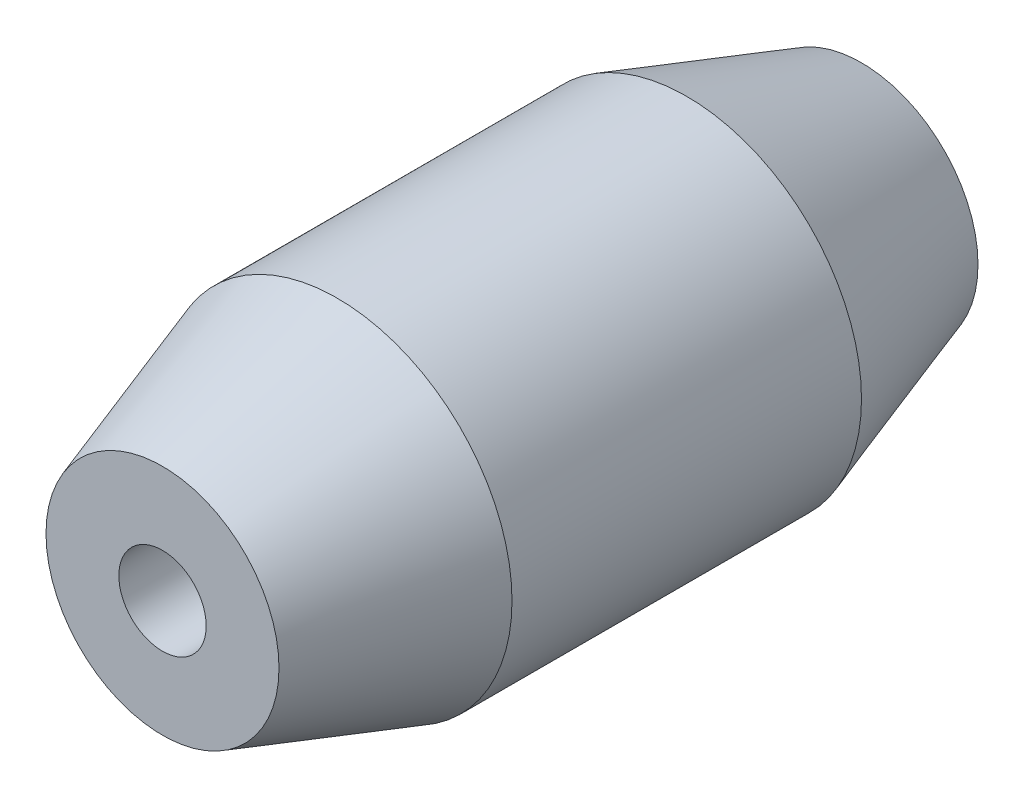
from build123d import *

# Parameters (mm, degrees)
ESQUISSE1_R        = 3
ESQUISSE1_R_2      = 0.75
BOSS_EXTRU_1_DEPTH = 12
CHANFREIN1_SIZE    = 3
CHANFREIN1_SIZE2   = 1
CHANFREIN2_SIZE    = 1
CHANFREIN2_SIZE2   = 3


with BuildPart() as part:
    # Esquisse1 → Boss.-Extru.1 (new body)
    with BuildSketch(Plane.XY):
        Circle(ESQUISSE1_R)
        Circle(ESQUISSE1_R_2, mode=Mode.SUBTRACT)
    extrude(amount=BOSS_EXTRU_1_DEPTH)

    # Chanfrein1
    chanfrein1_edges = [part.edges().sort_by_distance(p)[0] for p in [
        (-3, 0, 12),
    ]]
    chanfrein1_side = [part.faces().sort_by_distance(p)[0] for p in [
        (-3, 0, 6),
    ]]
    chamfer(chanfrein1_edges, length=CHANFREIN1_SIZE, length2=CHANFREIN1_SIZE2, reference=chanfrein1_side[0])

    # Chanfrein2
    chanfrein2_edges = [part.edges().sort_by_distance(p)[0] for p in [
        (-3, 0, 0),
    ]]
    chanfrein2_side = [part.faces().sort_by_distance(p)[0] for p in [
        (-2.915147186, 0, 0),
    ]]
    chamfer(chanfrein2_edges, length=CHANFREIN2_SIZE, length2=CHANFREIN2_SIZE2, reference=chanfrein2_side[0])


solid = part.part
